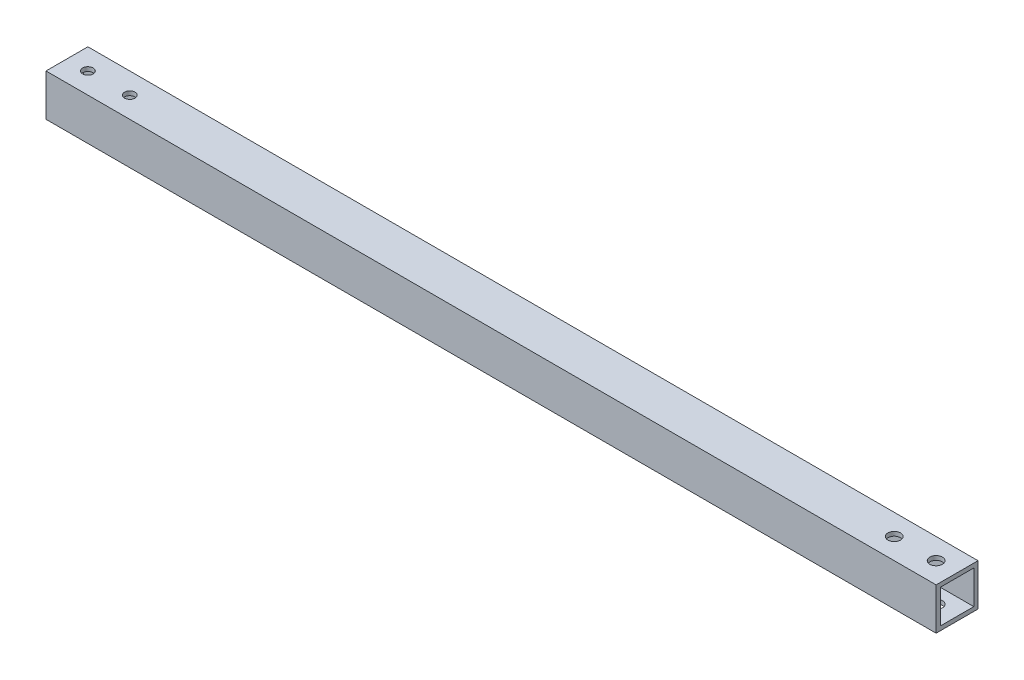
from build123d import *

# Parameters (mm, degrees)
SKETCH1_W           = 20
SKETCH1_H           = 20
SKETCH1_W_2         = 16
SKETCH1_H_2         = 16
BOSS_EXTRUDE1_DEPTH = 212.5
SKETCH2_R           = 3
CUT_EXTRUDE1_DEPTH  = 214.673231828
SKETCH3_R           = 2.5
CUT_EXTRUDE2_DEPTH  = 214.673231828


with BuildPart() as part:
    # Sketch1 → Boss-Extrude1 (new, symmetric)
    with BuildSketch(Plane(origin=(0, 0, 0), x_dir=(0, 0, -1), z_dir=(1, 0, 0))):
        Rectangle(SKETCH1_W, SKETCH1_H)
        Rectangle(SKETCH1_W_2, SKETCH1_H_2, mode=Mode.SUBTRACT)
    extrude(amount=BOSS_EXTRUDE1_DEPTH, both=True)

    # Sketch2 → Cut-Extrude1 (cut, through all)
    with BuildSketch(Plane(origin=(0, 10, 0), x_dir=(1, 0, 0), z_dir=(0, 1, 0))):
        with Locations(Location((182.5, 0, 0), (0, 0, 270))):
            Circle(SKETCH2_R)
        with Locations(Location((202.5, 0, 0), (0, 0, 270))):
            Circle(SKETCH2_R)
    extrude(amount=-CUT_EXTRUDE1_DEPTH, mode=Mode.SUBTRACT)

    # Sketch3 → Cut-Extrude2 (cut, through all)
    with BuildSketch(Plane(origin=(0, 10, 0), x_dir=(1, 0, 0), z_dir=(0, 1, 0))):
        with Locations(Location((-202.5, 0, 0), (0, 0, 270))):
            Circle(SKETCH3_R)
        with Locations(Location((-182.5, 0, 0), (0, 0, 270))):
            Circle(SKETCH3_R)
    extrude(amount=-CUT_EXTRUDE2_DEPTH, mode=Mode.SUBTRACT)


solid = part.part
